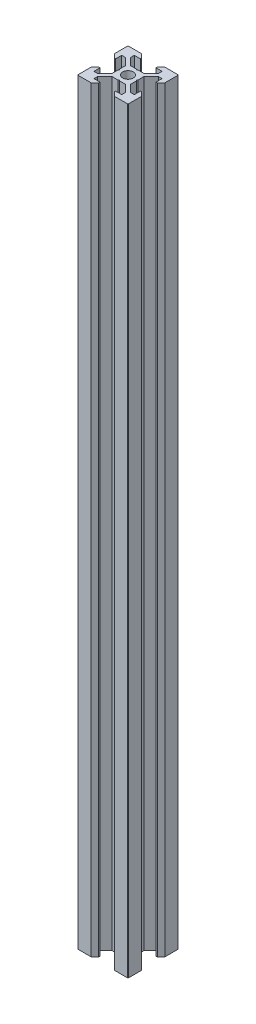
from build123d import *

# Parameters (mm, degrees)
ESQUISSE1_R        = 2.1
BOSS_EXTRU_1_DEPTH = 300


with BuildPart() as part:
    # Esquisse1 → Boss.-Extru.1 (new body)
    with BuildSketch(Plane(origin=(0, 0, 0), x_dir=(1, 0, 0), z_dir=(0, 1, 0))):
        with BuildLine():
            Line((3.7, 2.639339828), (6.560660172, 5.5))
            Line((6.560660172, 5.5), (8, 5.5))
            Line((8, 5.5), (8, 3.1))
            Line((8, 3.1), (8.52, 3.1))
            Line((8.52, 3.1), (10, 4.58))
            Line((10, 4.58), (10, 9.82))
            ThreePointArc((10, 9.82), (9.947279221, 9.947279221), (9.82, 10))
            Line((9.82, 10), (4.58, 10))
            Line((4.58, 10), (3.1, 8.52))
            Line((3.1, 8.52), (3.1, 8))
            Line((3.1, 8), (5.5, 8))
            Line((5.5, 8), (5.5, 6.560660172))
            Line((5.5, 6.560660172), (2.639339828, 3.7))
            Line((2.639339828, 3.7), (0.353553391, 3.7))
            Line((0.353553391, 3.7), (0, 3.346446609))
            Line((0, 3.346446609), (-0.353553391, 3.7))
            Line((-0.353553391, 3.7), (-2.639339828, 3.7))
            Line((-2.639339828, 3.7), (-5.5, 6.560660172))
            Line((-5.5, 6.560660172), (-5.5, 8))
            Line((-5.5, 8), (-3.1, 8))
            Line((-3.1, 8), (-3.1, 8.52))
            Line((-3.1, 8.52), (-4.58, 10))
            Line((-4.58, 10), (-9.82, 10))
            ThreePointArc((-9.82, 10), (-9.947279221, 9.947279221), (-10, 9.82))
            Line((-10, 9.82), (-10, 4.58))
            Line((-10, 4.58), (-8.52, 3.1))
            Line((-8.52, 3.1), (-8, 3.1))
            Line((-8, 3.1), (-8, 5.5))
            Line((-8, 5.5), (-6.560660172, 5.5))
            Line((-6.560660172, 5.5), (-3.7, 2.639339828))
            Line((-3.7, 2.639339828), (-3.7, 0.353553391))
            Line((-3.7, 0.353553391), (-3.346446609, 0))
            Line((-3.346446609, 0), (-3.7, -0.353553391))
            Line((-3.7, -0.353553391), (-3.7, -2.639339828))
            Line((-3.7, -2.639339828), (-6.560660172, -5.5))
            Line((-6.560660172, -5.5), (-8, -5.5))
            Line((-8, -5.5), (-8, -3.1))
            Line((-8, -3.1), (-8.52, -3.1))
            Line((-8.52, -3.1), (-10, -4.58))
            Line((-10, -4.58), (-10, -9.82))
            ThreePointArc((-10, -9.82), (-9.947279221, -9.947279221), (-9.82, -10))
            Line((-9.82, -10), (-4.58, -10))
            Line((-4.58, -10), (-3.1, -8.52))
            Line((-3.1, -8.52), (-3.1, -8))
            Line((-3.1, -8), (-5.5, -8))
            Line((-5.5, -8), (-5.5, -6.560660172))
            Line((-5.5, -6.560660172), (-2.639339828, -3.7))
            Line((-2.639339828, -3.7), (-0.353553391, -3.7))
            Line((-0.353553391, -3.7), (0, -3.346446609))
            Line((0, -3.346446609), (0.353553391, -3.7))
            Line((0.353553391, -3.7), (2.639339828, -3.7))
            Line((2.639339828, -3.7), (5.5, -6.560660172))
            Line((5.5, -6.560660172), (5.5, -8))
            Line((5.5, -8), (3.1, -8))
            Line((3.1, -8), (3.1, -8.52))
            Line((3.1, -8.52), (4.58, -10))
            Line((4.58, -10), (9.82, -10))
            ThreePointArc((9.82, -10), (9.947279221, -9.947279221), (10, -9.82))
            Line((10, -9.82), (10, -4.58))
            Line((10, -4.58), (8.52, -3.1))
            Line((8.52, -3.1), (8, -3.1))
            Line((8, -3.1), (8, -5.5))
            Line((8, -5.5), (6.560660172, -5.5))
            Line((6.560660172, -5.5), (3.7, -2.639339828))
            Line((3.7, -2.639339828), (3.7, -0.353553391))
            Line((3.7, -0.353553391), (3.346446609, 0))
            Line((3.346446609, 0), (3.7, 0.353553391))
            Line((3.7, 0.353553391), (3.7, 2.639339828))
        make_face()
        with Locations(Location((0, 0, 0), (0, 0, 270))):
            Circle(ESQUISSE1_R, mode=Mode.SUBTRACT)
    extrude(amount=BOSS_EXTRU_1_DEPTH)


solid = part.part
